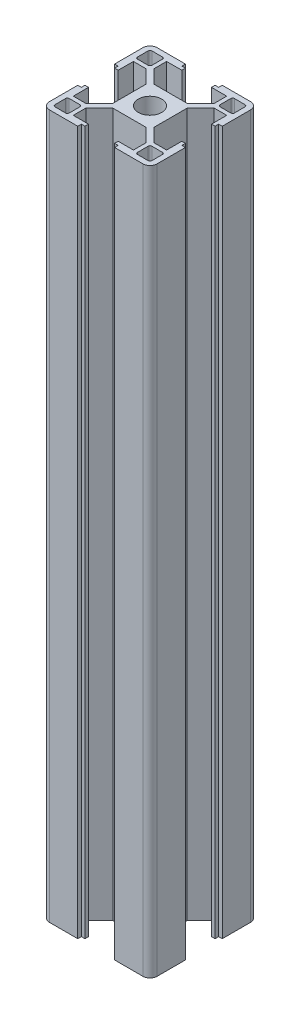
from build123d import *

# Parameters (mm, degrees)
SKETCH1_W           = 4
SKETCH1_H           = 4
SKETCH1_R           = 3.25
BOSS_EXTRUDE1_DEPTH = 196
SKETCH2_W           = 1
SKETCH2_H           = 1
CUT_EXTRUDE1_DEPTH  = 198.144616969
FILLET1_R           = 0.5


with BuildPart() as part:
    # Sketch1 → Boss-Extrude1 (new body)
    with BuildSketch(Plane(origin=(0, 0, 0), x_dir=(1, 0, 0), z_dir=(0, 1, 0))):
        with BuildLine():
            Line((-8.375, 9.50637085), (-8.375, 13))
            Line((-8.375, 13), (-4.125, 13))
            Line((-4.125, 13), (-4.125, 15))
            Line((-4.125, 15), (-13, 15))
            ThreePointArc((-13, 15), (-14.414213562, 14.414213562), (-15, 13))
            Line((-15, 13), (-15, 4.125))
            Line((-15, 4.125), (-13, 4.125))
            Line((-13, 4.125), (-13, 8.375))
            Line((-13, 8.375), (-9.50637085, 8.375))
            Line((-9.50637085, 8.375), (-5.75, 4.61862915))
            Line((-5.75, 4.61862915), (-5.75, -4.61862915))
            Line((-5.75, -4.61862915), (-9.50637085, -8.375))
            Line((-9.50637085, -8.375), (-13, -8.375))
            Line((-13, -8.375), (-13, -4.125))
            Line((-13, -4.125), (-15, -4.125))
            Line((-15, -4.125), (-15, -13))
            ThreePointArc((-15, -13), (-14.414213562, -14.414213562), (-13, -15))
            Line((-13, -15), (-4.125, -15))
            Line((-4.125, -15), (-4.125, -13))
            Line((-4.125, -13), (-8.375, -13))
            Line((-8.375, -13), (-8.375, -9.50637085))
            Line((-8.375, -9.50637085), (-4.61862915, -5.75))
            Line((-4.61862915, -5.75), (4.61862915, -5.75))
            Line((4.61862915, -5.75), (8.375, -9.50637085))
            Line((8.375, -9.50637085), (8.375, -13))
            Line((8.375, -13), (4.125, -13))
            Line((4.125, -13), (4.125, -15))
            Line((4.125, -15), (13, -15))
            ThreePointArc((13, -15), (14.414213562, -14.414213562), (15, -13))
            Line((15, -13), (15, -4.125))
            Line((15, -4.125), (13, -4.125))
            Line((13, -4.125), (13, -8.375))
            Line((13, -8.375), (9.50637085, -8.375))
            Line((9.50637085, -8.375), (5.75, -4.61862915))
            Line((5.75, -4.61862915), (5.75, 4.61862915))
            Line((5.75, 4.61862915), (9.50637085, 8.375))
            Line((9.50637085, 8.375), (13, 8.375))
            Line((13, 8.375), (13, 4.125))
            Line((13, 4.125), (15, 4.125))
            Line((15, 4.125), (15, 13))
            ThreePointArc((15, 13), (14.414213562, 14.414213562), (13, 15))
            Line((13, 15), (4.125, 15))
            Line((4.125, 15), (4.125, 13))
            Line((4.125, 13), (8.375, 13))
            Line((8.375, 13), (8.375, 9.50637085))
            Line((8.375, 9.50637085), (4.61862915, 5.75))
            Line((4.61862915, 5.75), (-4.61862915, 5.75))
            Line((-4.61862915, 5.75), (-8.375, 9.50637085))
        make_face()
        with Locations((-11.5, -11.5)):
            Rectangle(SKETCH1_W, SKETCH1_H, mode=Mode.SUBTRACT)
        with Locations((11.5, -11.5)):
            Rectangle(SKETCH1_W, SKETCH1_H, mode=Mode.SUBTRACT)
        Polygon((-9.5, 9.5), (-10.63137085, 9.5), (-13.5, 9.5), (-13.5, 13.5), (-9.5, 13.5), align=None, mode=Mode.SUBTRACT)
        with Locations(Location((0, 0, 0), (0, 0, 270))):
            Circle(SKETCH1_R, mode=Mode.SUBTRACT)
        with Locations((11.5, 11.5)):
            Rectangle(SKETCH1_W, SKETCH1_H, mode=Mode.SUBTRACT)
    extrude(amount=BOSS_EXTRUDE1_DEPTH)

    # Sketch2 → Cut-Extrude1 (cut, through all)
    with BuildSketch(Plane(origin=(0, 196, 0), x_dir=(1, 0, 0), z_dir=(0, 1, 0))):
        with Locations((14.5, 4.625)):
            Rectangle(SKETCH2_W, SKETCH2_H)
        with Locations((-4.625, 14.5)):
            Rectangle(SKETCH2_W, SKETCH2_H)
        with Locations((4.625, 14.5)):
            Rectangle(SKETCH2_W, SKETCH2_H)
        with Locations((14.5, -4.625)):
            Rectangle(SKETCH2_W, SKETCH2_H)
        with Locations((4.625, -14.5)):
            Rectangle(SKETCH2_W, SKETCH2_H)
        with Locations((-4.625, -14.5)):
            Rectangle(SKETCH2_W, SKETCH2_H)
        with Locations((-14.5, -4.625)):
            Rectangle(SKETCH2_W, SKETCH2_H)
        with Locations((-14.5, 4.625)):
            Rectangle(SKETCH2_W, SKETCH2_H)
    extrude(amount=-CUT_EXTRUDE1_DEPTH, mode=Mode.SUBTRACT)

    # Fillet1
    fillet1_edges = [part.edges().sort_by_distance(p)[0] for p in [
        (-9.5, 98, -13.5),
        (-13.5, 98, -13.5),
        (-13.5, 98, -9.5),
        (-9.5, 98, -9.5),
        (-9.5, 98, 9.5),
        (-13.5, 98, 9.5),
        (-13.5, 98, 13.5),
        (-9.5, 98, 13.5),
        (9.5, 98, -9.5),
        (13.5, 98, -9.5),
        (13.5, 98, -13.5),
        (9.5, 98, -13.5),
        (13.5, 98, 13.5),
        (13.5, 98, 9.5),
        (9.5, 98, 9.5),
        (9.5, 98, 13.5),
    ]]
    fillet(fillet1_edges, radius=FILLET1_R)


solid = part.part
